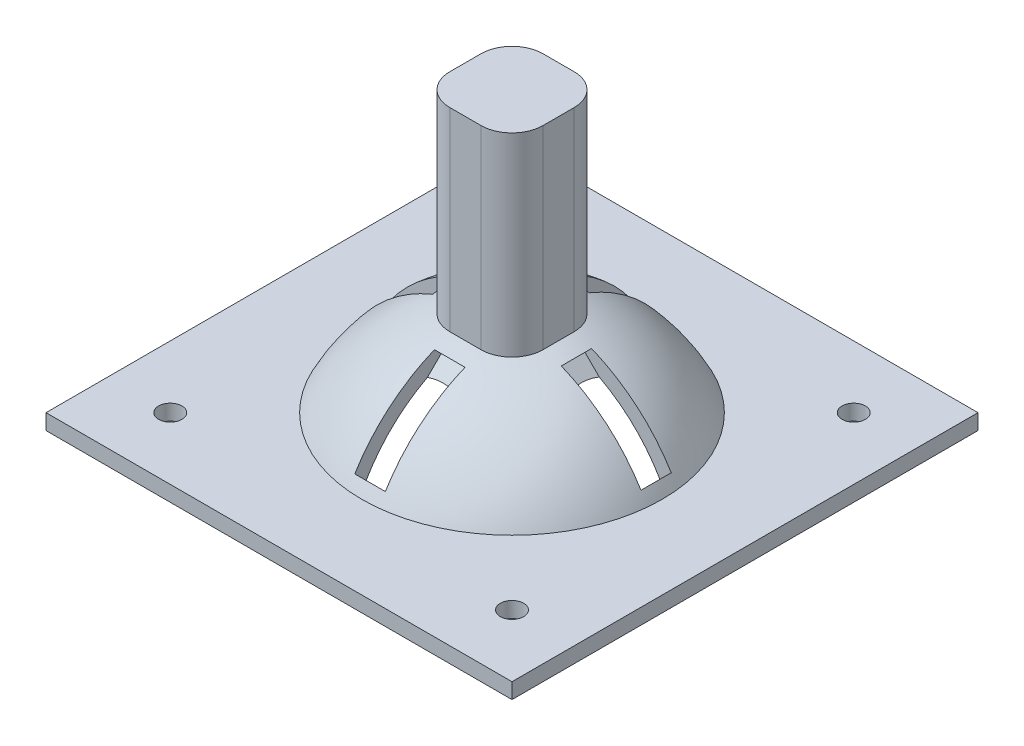
from build123d import *

# Parameters (mm, degrees)
BOSS_EXTRUDE1_DEPTH  = 31.75
FILLET1_R            = 5.08
BOSS_EXTRUDE2_DEPTH  = 2.5399999999999996
SKETCH5_R            = 21.59
CUT_EXTRUDE1_DEPTH   = 2.54
SKETCH6_R            = 1.905
CUT_EXTRUDE2_DEPTH   = 2.54
LPATTERN1_COUNT      = 2
LPATTERN1_PITCH      = 55.88
LPATTERN1_COUNT_DIR2 = 2
LPATTERN1_PITCH_DIR2 = 55.88
SKETCH7_W            = 4.973168332467609
SKETCH7_H            = 17.05086285420509
CUT_EXTRUDE3_DEPTH   = 5.08
CIRPATTERN1_COUNT    = 4


with BuildPart() as part:
    # Sketch1 → Boss-Extrude1 (new body)
    with BuildSketch(Plane(origin=(0, 0, 0), x_dir=(1, 0, 0), z_dir=(0, 1, 0))):
        Polygon((7.620000000000001, -7.619999999999999), (-7.619999999999997, -7.620000000000001), (-7.619999999999997, 7.619999999999997), (7.62, 7.619999999999999), align=None)
    extrude(amount=BOSS_EXTRUDE1_DEPTH)

    # Fillet1
    fillet1_edges = [part.edges().sort_by_distance(p)[0] for p in [
        (-7.619999999999997, 15.875, -7.619999999999997),
        (7.62, 15.875, -7.619999999999999),
        (7.620000000000001, 15.875, 7.619999999999999),
        (-7.619999999999997, 15.875, 7.620000000000001),
    ]]
    fillet(fillet1_edges, radius=FILLET1_R)

    # Sketch3 → Revolve1 (revolve)
    with BuildSketch(Plane(origin=(0, 0, 0), x_dir=(0, 0, -1), z_dir=(1, 0, 0)), mode=Mode.PRIVATE) as revolve1_sk:
        with BuildLine():
            Line((21.671034774775425, -13.993670695701732), (24.558499604544867, -13.993670695701732))
            ThreePointArc((24.558499604544867, -13.993670695701732), (14.4064356448173, -2.992535685286647), (0, 1.0748942368530439))
            Line((0, 1.0748942368530439), (0, -1.4651057631469566))
            ThreePointArc((0, -1.4651057631469566), (12.515976664635154, -4.822647383136747), (21.671034774775425, -13.993670695701732))
        make_face()
    revolve(revolve1_sk.sketch.rotate(Axis((0, -1.26539568401347, 0), (0, -1, 0)), 180), axis=Axis((0, -1.26539568401347, 0), (0, -1, 0)))

    # Sketch4 → Boss-Extrude2 (add)
    with BuildSketch(Plane.XZ.offset(13.993670695701732)):
        Polygon((38.10000000000001, -38.099999999999994), (-38.099999999999994, -38.10000000000001), (-38.099999999999994, 38.099999999999994), (38.10000000000001, 38.10000000000001), align=None)
    extrude(amount=BOSS_EXTRUDE2_DEPTH)

    # Sketch5 → Cut-Extrude1 (cut)
    with BuildSketch(Plane.XZ.offset(16.533670695701733)):
        with Locations(Location((0, 0, 0), (0, 0, 270))):
            Circle(SKETCH5_R)
    extrude(amount=-CUT_EXTRUDE1_DEPTH, mode=Mode.SUBTRACT)

    # Sketch6 → Cut-Extrude2 (cut)
    with BuildSketch(Plane(origin=(0, -13.993670695701732, 0), x_dir=(1, 0, 0), z_dir=(0, 1, 0))):
        with Locations(Location((-27.939999999999998, 27.94000000000001, 0), (0, 0, 270))):
            Circle(SKETCH6_R)
    cut_extrude2 = extrude(amount=-CUT_EXTRUDE2_DEPTH, mode=Mode.SUBTRACT)

    # LPattern1: Cut-Extrude2 2 × 2
    with Locations(*[(i * LPATTERN1_PITCH, 0, j * LPATTERN1_PITCH_DIR2) for i in range(LPATTERN1_COUNT) for j in range(LPATTERN1_COUNT_DIR2) if (i, j) != (0, 0)]):
        add(cut_extrude2, mode=Mode.SUBTRACT)

    # Sketch7 → Cut-Extrude3 (cut)
    with BuildSketch(Plane(origin=(-8.1e-16, 7.15367689428744, -7.153676894287446), x_dir=(-1, -6e-17, 6e-17), z_dir=(0, 0.7071067811865475, -0.7071067811865477))):
        with Locations((0.17761315473098493, -16.595227399410156)):
            Rectangle(SKETCH7_W, SKETCH7_H)
    cut_extrude3 = extrude(amount=-CUT_EXTRUDE3_DEPTH, mode=Mode.SUBTRACT)

    # CirPattern1: Cut-Extrude3 ×4 about axis
    cirpattern1_axis = Axis((0, 0, 0), (0, 1, 0))
    for i in range(1, CIRPATTERN1_COUNT):
        add(cut_extrude3.rotate(cirpattern1_axis, i * 360 / CIRPATTERN1_COUNT), mode=Mode.SUBTRACT)


solid = part.part
